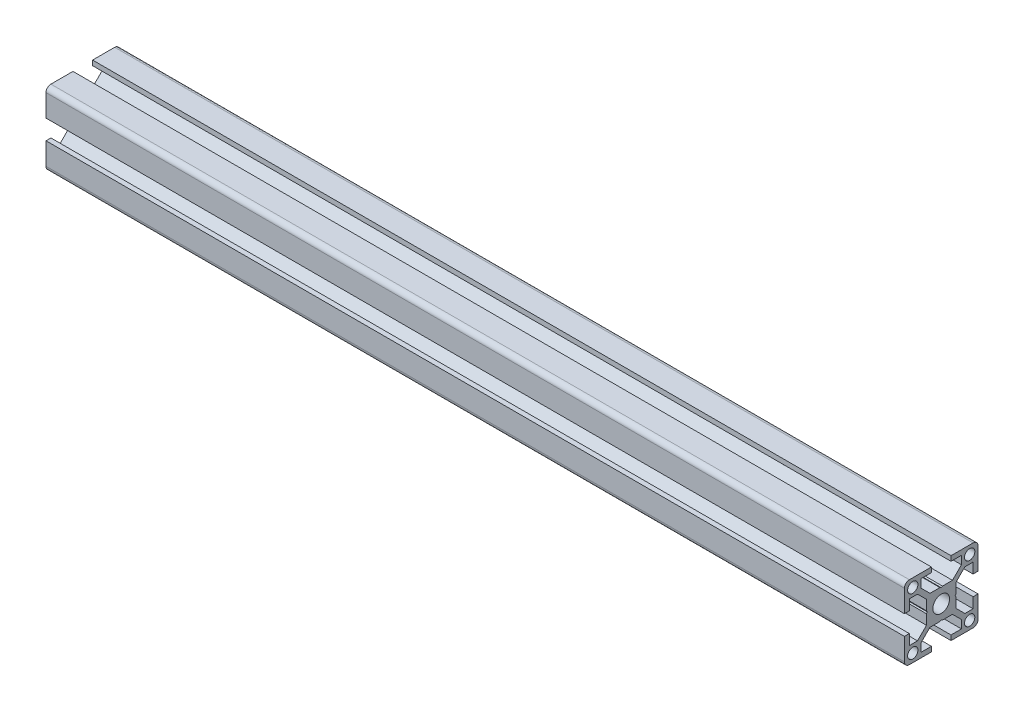
from build123d import *

# Parameters (mm, degrees)
SKETCH1_R           = 3.4
SKETCH1_R_2         = 2.1
BOSS_EXTRUDE1_DEPTH = 350


with BuildPart() as part:
    # Sketch1 → Boss-Extrude1 (new body)
    with BuildSketch(Plane(origin=(0, 0, 0), x_dir=(0, -1, 0), z_dir=(-1, 0, 0))):
        with BuildLine():
            Line((13, -4), (13, -8.25))
            Line((13, -8.25), (9.664213562, -8.25))
            Line((9.664213562, -8.25), (6, -4.585786438))
            Line((6, -4.585786438), (6, -0.519615242))
            Line((6, -0.519615242), (5.7, 0))
            Line((5.7, 0), (6, 0.519615242))
            Line((6, 0.519615242), (6, 4.585786438))
            Line((6, 4.585786438), (9.664213562, 8.25))
            Line((9.664213562, 8.25), (13, 8.25))
            Line((13, 8.25), (13, 4))
            Line((13, 4), (15, 4))
            Line((15, 4), (15, 13))
            ThreePointArc((15, 13), (14.414213562, 14.414213562), (13, 15))
            Line((13, 15), (4, 15))
            Line((4, 15), (4, 13))
            Line((4, 13), (8.25, 13))
            Line((8.25, 13), (8.25, 9.664213562))
            Line((8.25, 9.664213562), (4.585786438, 6))
            Line((4.585786438, 6), (0.519615242, 6))
            Line((0.519615242, 6), (0, 5.7))
            Line((0, 5.7), (-0.519615242, 6))
            Line((-0.519615242, 6), (-4.585786438, 6))
            Line((-4.585786438, 6), (-8.25, 9.664213562))
            Line((-8.25, 9.664213562), (-8.25, 13))
            Line((-8.25, 13), (-4, 13))
            Line((-4, 13), (-4, 15))
            Line((-4, 15), (-13, 15))
            ThreePointArc((-13, 15), (-14.414213562, 14.414213562), (-15, 13))
            Line((-15, 13), (-15, 4))
            Line((-15, 4), (-13, 4))
            Line((-13, 4), (-13, 8.25))
            Line((-13, 8.25), (-9.664213562, 8.25))
            Line((-9.664213562, 8.25), (-6, 4.585786438))
            Line((-6, 4.585786438), (-6, 0.519615242))
            Line((-6, 0.519615242), (-5.7, 0))
            Line((-5.7, 0), (-6, -0.519615242))
            Line((-6, -0.519615242), (-6, -4.585786438))
            Line((-6, -4.585786438), (-9.664213562, -8.25))
            Line((-9.664213562, -8.25), (-13, -8.25))
            Line((-13, -8.25), (-13, -4))
            Line((-13, -4), (-15, -4))
            Line((-15, -4), (-15, -13))
            ThreePointArc((-15, -13), (-14.414213562, -14.414213562), (-13, -15))
            Line((-13, -15), (-4, -15))
            Line((-4, -15), (-4, -13))
            Line((-4, -13), (-8.25, -13))
            Line((-8.25, -13), (-8.25, -9.664213562))
            Line((-8.25, -9.664213562), (-4.585786438, -6))
            Line((-4.585786438, -6), (-0.519615242, -6))
            Line((-0.519615242, -6), (0, -5.7))
            Line((0, -5.7), (0.519615242, -6))
            Line((0.519615242, -6), (4.585786438, -6))
            Line((4.585786438, -6), (8.25, -9.664213562))
            Line((8.25, -9.664213562), (8.25, -13))
            Line((8.25, -13), (4, -13))
            Line((4, -13), (4, -15))
            Line((4, -15), (13, -15))
            ThreePointArc((13, -15), (14.414213562, -14.414213562), (15, -13))
            Line((15, -13), (15, -4))
            Line((15, -4), (13, -4))
        make_face()
        with Locations(Location((0, 0, 0), (0, 0, 270))):
            Circle(SKETCH1_R, mode=Mode.SUBTRACT)
        with Locations(Location((11.6, -11.6, 0), (0, 0, 270))):
            Circle(SKETCH1_R_2, mode=Mode.SUBTRACT)
        with Locations(Location((11.6, 11.6, 0), (0, 0, 270))):
            Circle(SKETCH1_R_2, mode=Mode.SUBTRACT)
        with Locations(Location((-11.6, 11.6, 0), (0, 0, 270))):
            Circle(SKETCH1_R_2, mode=Mode.SUBTRACT)
        with Locations(Location((-11.6, -11.6, 0), (0, 0, 270))):
            Circle(SKETCH1_R_2, mode=Mode.SUBTRACT)
    extrude(amount=-BOSS_EXTRUDE1_DEPTH)


solid = part.part
